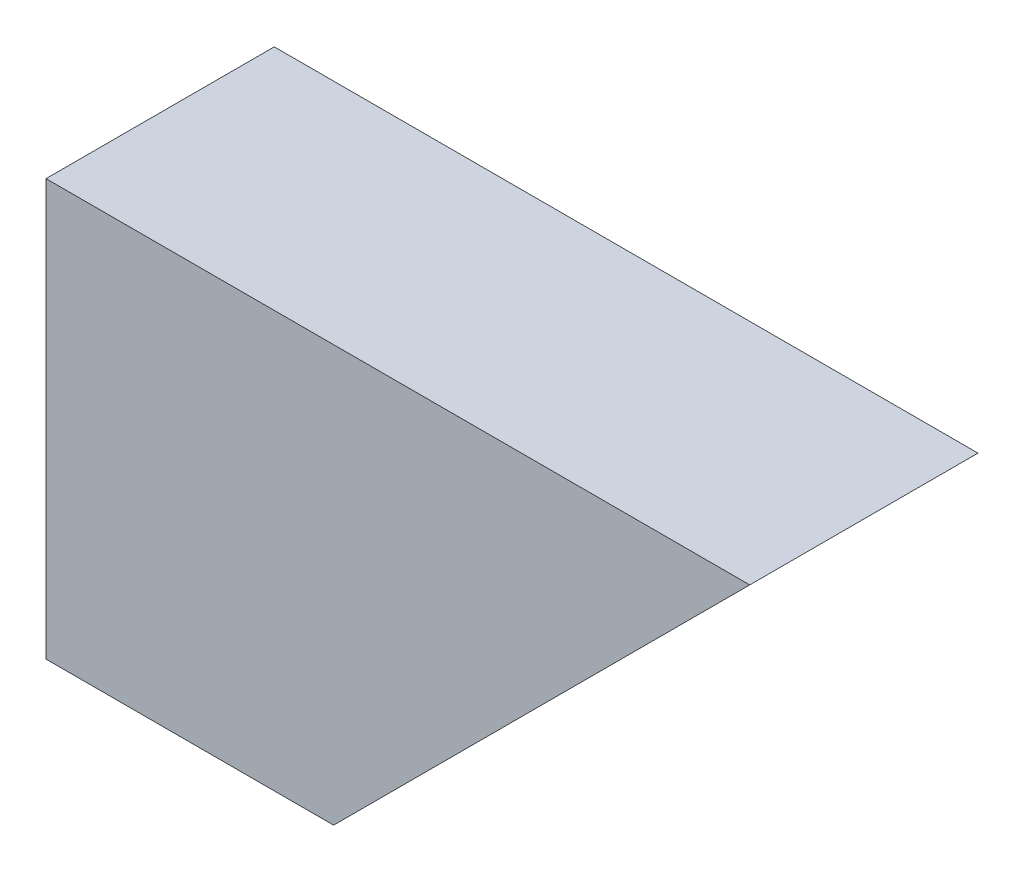
from build123d import *

# Parameters (mm, degrees)
MAIN_EXTRUSION_DEPTH = 50


with BuildPart() as part:
    # Main-Sketch → Main-Extrusion (new body)
    with BuildSketch(Plane.XY):
        Polygon((0, 91.15), (154.15, 91.15), (63, 0), (0, 0), align=None)
    extrude(amount=MAIN_EXTRUSION_DEPTH)


solid = part.part
